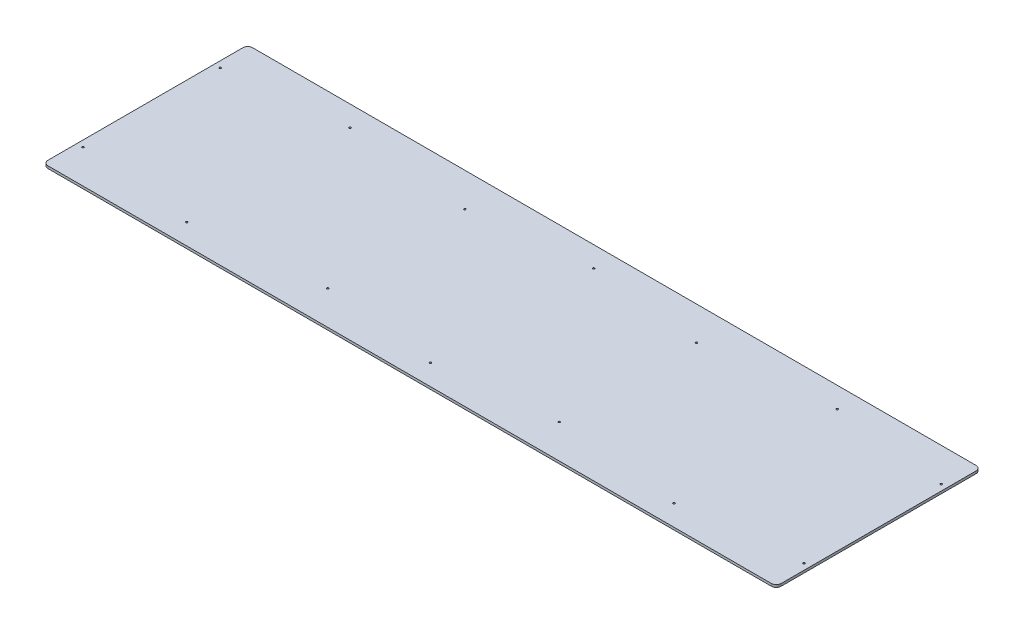
from build123d import *

# Parameters (mm, degrees)
SKETCH1_W           = 1911.35
SKETCH1_H           = 533.4
BOSS_EXTRUDE1_DEPTH = 6.35
FILLET1_R           = 12.7
SKETCH2_R           = 2.4511
CUT_EXTRUDE1_DEPTH  = 6.35
SKETCH7_R           = 2.4511
CUT_EXTRUDE2_DEPTH  = 6.35


with BuildPart() as part:
    # Sketch1 → Boss-Extrude1 (new body)
    with BuildSketch(Plane(origin=(0, 0, 0), x_dir=(1, 0, 0), z_dir=(0, 1, 0))):
        with Locations((955.675, 266.7)):
            Rectangle(SKETCH1_W, SKETCH1_H)
    extrude(amount=BOSS_EXTRUDE1_DEPTH)

    # Fillet1
    fillet1_edges = [part.edges().sort_by_distance(p)[0] for p in [
        (0, 3.175, -533.4),
        (1911.35, 3.175, -533.4),
        (1911.35, 3.175, 0),
        (0, 3.175, 0),
    ]]
    fillet(fillet1_edges, radius=FILLET1_R)

    # Sketch2 → Cut-Extrude1 (cut)
    with BuildSketch(Plane(origin=(0, 6.35, 0), x_dir=(1, 0, 0), z_dir=(0, 1, 0))):
        with Locations(Location((15.875, 445.643, 0), (0, 0, 270))):
            Circle(SKETCH2_R)
        with Locations(Location((653.965333418, 445.643, 0), (0, 0, 270))):
            Circle(SKETCH2_R)
        with Locations(Location((653.965333418, 88.011, 0), (0, 0, 270))):
            Circle(SKETCH2_R)
        with Locations(Location((15.875, 88.011, 0), (0, 0, 270))):
            Circle(SKETCH2_R)
        with Locations(Location((1257.384666582, 445.643, 0), (0, 0, 270))):
            Circle(SKETCH2_R)
        with Locations(Location((1257.384666582, 88.011, 0), (0, 0, 270))):
            Circle(SKETCH2_R)
        with Locations(Location((1895.475, 445.643, 0), (0, 0, 270))):
            Circle(SKETCH2_R)
        with Locations(Location((1895.475, 88.011, 0), (0, 0, 270))):
            Circle(SKETCH2_R)
    extrude(amount=-CUT_EXTRUDE1_DEPTH, mode=Mode.SUBTRACT)

    # Sketch7 → Cut-Extrude2 (cut)
    with BuildSketch(Plane(origin=(0, 6.35, 0), x_dir=(1, 0, 0), z_dir=(0, 1, 0))):
        with Locations(Location((320.675, 479.425, 0), (0, 0, 270))):
            Circle(SKETCH7_R)
        with Locations(Location((320.675, 53.975, 0), (0, 0, 270))):
            Circle(SKETCH7_R)
        with Locations(Location((955.675, 53.975, 0), (0, 0, 270))):
            Circle(SKETCH7_R)
        with Locations(Location((955.675, 479.425, 0), (0, 0, 270))):
            Circle(SKETCH7_R)
        with Locations(Location((1590.675, 479.425, 0), (0, 0, 270))):
            Circle(SKETCH7_R)
        with Locations(Location((1590.675, 53.975, 0), (0, 0, 270))):
            Circle(SKETCH7_R)
    extrude(amount=-CUT_EXTRUDE2_DEPTH, mode=Mode.SUBTRACT)


solid = part.part
